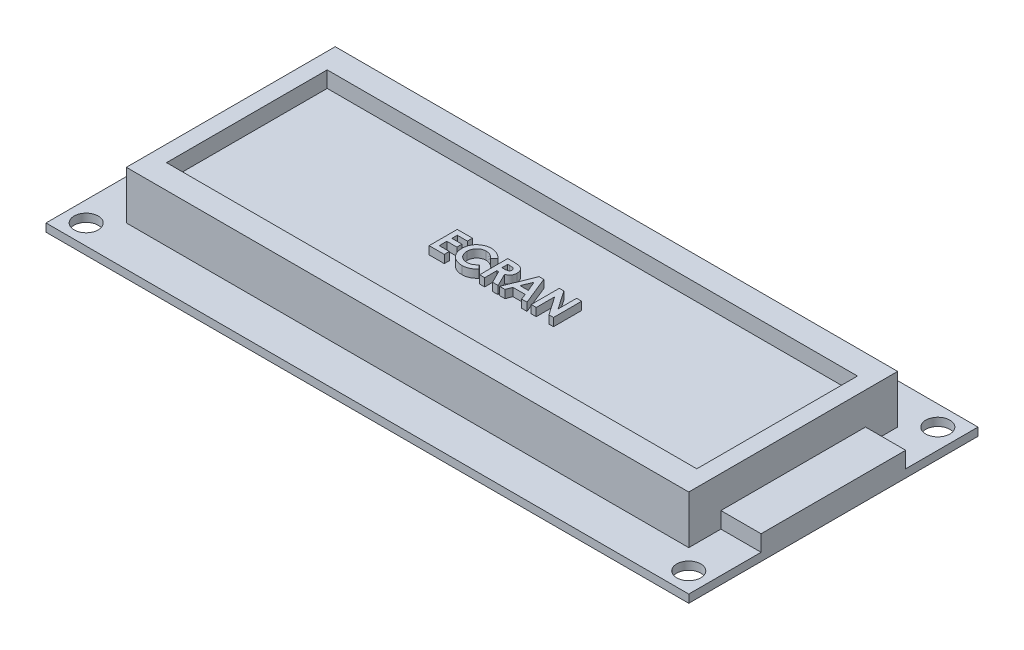
from build123d import *

# Parameters (mm, degrees)
ESQUISSE1_W                = 80
ESQUISSE1_H                = 36
ESQUISSE1_R                = 1.5
PLAQUE_PCB_DEPTH           = 1
ESQUISSE2_W                = 70
ESQUISSE2_H                = 26
CADRE_ECRAN_DEPTH          = 6
ESQUISSE5_W                = 66
ESQUISSE5_H                = 20
VITRE_ECRAN_DEPTH          = 2
TEXTE_ECRAN_DEPTH          = 1
BLOC_RETROECLAIREAGE_DEPTH = 2


with BuildPart() as part:
    # Esquisse1 → Plaque PCB (new body)
    with BuildSketch(Plane(origin=(0, 0, 0), x_dir=(1, 0, 0), z_dir=(0, 1, 0))):
        with Locations((40, 18)):
            Rectangle(ESQUISSE1_W, ESQUISSE1_H)
        with Locations(Location((2.5, 33.5, 0), (0, 0, 270))):
            Circle(ESQUISSE1_R, mode=Mode.SUBTRACT)
        with Locations(Location((77.5, 33.5, 0), (0, 0, 270))):
            Circle(ESQUISSE1_R, mode=Mode.SUBTRACT)
        with Locations(Location((2.5, 2.5, 0), (0, 0, 270))):
            Circle(ESQUISSE1_R, mode=Mode.SUBTRACT)
        with Locations(Location((77.5, 2.5, 0), (0, 0, 270))):
            Circle(ESQUISSE1_R, mode=Mode.SUBTRACT)
    extrude(amount=PLAQUE_PCB_DEPTH)

    # Esquisse2 → Cadre ecran (add)
    with BuildSketch(Plane(origin=(0, 1, 0), x_dir=(1, 0, 0), z_dir=(0, 1, 0))):
        with Locations((40, 18)):
            Rectangle(ESQUISSE2_W, ESQUISSE2_H)
    extrude(amount=CADRE_ECRAN_DEPTH)

    # Esquisse5 → Vitre ecran (cut)
    with BuildSketch(Plane(origin=(0, 7, 0), x_dir=(1, 0, 0), z_dir=(0, 1, 0))):
        with Locations((40, 18)):
            Rectangle(ESQUISSE5_W, ESQUISSE5_H)
    extrude(amount=-VITRE_ECRAN_DEPTH, mode=Mode.SUBTRACT)

    # Esquisse6 → Texte ECRAN (add)
    # profile 1 of 5: a face of its own
    with BuildSketch(Plane(origin=(0, 5, 0), x_dir=(1, 0, 0), z_dir=(0, 1, 0))):
        Polygon((31.289059195, 19.898736743), (33.173674579, 19.898736743), (33.173674579, 19.270531615), (31.917264323, 19.270531615), (31.917264323, 18.597454692), (33.173674579, 18.597454692), (33.173674579, 17.969249564), (31.917264323, 17.969249564), (31.917264323, 17.026941871), (33.173674579, 17.026941871), (33.173674579, 16.398736743), (31.289059195, 16.398736743), align=None)
    # profile 2 of 5: a face of its own
    with BuildSketch(Plane(origin=(0, 5, 0), x_dir=(1, 0, 0), z_dir=(0, 1, 0))):
        with BuildLine():
            Line((36.942905348, 19.291565269), (36.482268329, 18.851260782))
            add(Edge.make_bspline(
                [(36.482268329, 18.851260782), (36.443193344, 18.891664381), (36.366867658, 18.97058527), (36.243878253, 19.07506957), (36.11597375, 19.162143098), (35.985642275, 19.235475868), (35.850539544, 19.290957336), (35.712227712, 19.331387616), (35.569823617, 19.356036429), (35.473450002, 19.35885669), (35.424976663, 19.360275205)],
                knots=[0, 0, 0, 0, 1.115251505, 2.178435587, 3.19620269, 4.182487026, 5.141301733, 6.088180966, 7.038406374, 8, 8, 8, 8], degree=3))
            add(Edge.make_bspline(
                [(35.424976663, 19.360275205), (35.384495533, 19.359154528), (35.304610485, 19.356942996), (35.1873183, 19.340730286), (35.075122263, 19.313159867), (34.96763831, 19.275162722), (34.865182716, 19.225996434), (34.767540671, 19.165699055), (34.674952908, 19.094815156), (34.588642456, 19.013711495), (34.509688687, 18.925099651), (34.439928006, 18.830551024), (34.381492245, 18.730282221), (34.333534967, 18.62530869), (34.2961781, 18.515144562), (34.269500605, 18.399864003), (34.254071054, 18.279329723), (34.25176809, 18.197391418), (34.250597656, 18.155747961)],
                knots=[0, 0, 0, 0, 1.035432265, 2.043311493, 3.022114605, 3.98653278, 4.95457646, 5.923598177, 6.917315552, 7.932509744, 8.948865224, 9.949768934, 10.933144597, 11.912367597, 12.897413939, 13.903909035, 14.934704909, 16, 16, 16, 16], degree=3))
            add(Edge.make_bspline(
                [(34.250597656, 18.155747961), (34.250934962, 18.126519669), (34.251599798, 18.068910106), (34.25887761, 17.983689572), (34.270596602, 17.901005507), (34.287556887, 17.820983155), (34.308765891, 17.743553169), (34.333648881, 17.668047563), (34.364864227, 17.595509655), (34.399513731, 17.525096965), (34.439810706, 17.45873079), (34.483258278, 17.395445135), (34.530370076, 17.335550218), (34.581451247, 17.279290894), (34.637220694, 17.227546367), (34.696236983, 17.178760621), (34.759495637, 17.134154925), (34.825682615, 17.092609853), (34.895369687, 17.056519295), (34.966666081, 17.023828222), (35.040652796, 16.99727821), (35.116428998, 16.975876479), (35.19372389, 16.957677502), (35.273293487, 16.946471833), (35.354448021, 16.937985911), (35.409294864, 16.937461955), (35.436895733, 16.937198282)],
                knots=[0, 0, 0, 0, 1.103660481, 2.175337485, 3.227646561, 4.255952547, 5.262355991, 6.258840057, 7.255597736, 8.242457506, 9.22035537, 10.185017736, 11.140346927, 12.096287581, 13.051739095, 14.01125915, 14.986044842, 15.97314143, 16.960198552, 17.947847494, 18.933482797, 19.925264591, 20.920966487, 21.929612487, 22.958107872, 24, 24, 24, 24], degree=3))
            add(Edge.make_bspline(
                [(35.436895733, 16.937198282), (35.48371155, 16.938552444), (35.575692456, 16.941213019), (35.710687662, 16.962018347), (35.839324644, 16.996241932), (35.942104977, 17.036657998), (36.022630654, 17.076569388), (36.083933661, 17.113485458), (36.147325748, 17.154780136), (36.211754027, 17.202011927), (36.277943188, 17.254614031), (36.34472484, 17.313738532), (36.413808605, 17.377438545), (36.459064694, 17.422902495), (36.482268329, 17.446212705)],
                knots=[0, 0, 0, 0, 1.404581149, 2.759636711, 4.088442092, 5.392261763, 6.066678138, 6.783632037, 7.538459478, 8.336747902, 9.180226004, 10.074962426, 11.012997595, 12, 12, 12, 12], degree=3))
            Line((36.482268329, 17.446212705), (36.928882913, 16.977162224))
            add(Edge.make_bspline(
                [(36.928882913, 16.977162224), (36.897488311, 16.946851722), (36.836212763, 16.887692104), (36.743780301, 16.803690968), (36.651464168, 16.728206609), (36.561494531, 16.658499275), (36.472397592, 16.596599712), (36.384182801, 16.542446098), (36.297848787, 16.494668811), (36.211602798, 16.454073592), (36.124908165, 16.419604035), (36.035709576, 16.389928008), (35.943734342, 16.364823157), (35.84842072, 16.34456684), (35.750657739, 16.328324007), (35.649530465, 16.31736019), (35.545680097, 16.30998958), (35.475236783, 16.309327269), (35.43970022, 16.308993153)],
                knots=[0, 0, 0, 0, 1.244526981, 2.429050516, 3.560637417, 4.644440555, 5.67424972, 6.652764056, 7.595344123, 8.486817594, 9.369275933, 10.254498637, 11.166417451, 12.086725134, 13.032340136, 13.991389299, 14.986715468, 16, 16, 16, 16], degree=3))
            add(Edge.make_bspline(
                [(35.43970022, 16.308993153), (35.374423956, 16.310657176), (35.246696452, 16.313913204), (35.059515126, 16.338038173), (34.88169789, 16.378483259), (34.712812149, 16.435683765), (34.552911605, 16.508754731), (34.402037165, 16.598336304), (34.260432004, 16.70419048), (34.129240015, 16.825076546), (34.010570618, 16.958585057), (33.905680612, 17.101936572), (33.818915596, 17.255835609), (33.746872734, 17.418008589), (33.690536163, 17.589195571), (33.650884767, 17.769581726), (33.626432041, 17.95899288), (33.623756878, 18.088365064), (33.622392528, 18.154345718)],
                knots=[0, 0, 0, 0, 1.078019885, 2.10938526, 3.111377082, 4.085535484, 5.04941344, 6.010039228, 6.978205633, 7.964457913, 8.951525778, 9.924444315, 10.892603023, 11.863865945, 12.85144698, 13.863884204, 14.910567087, 16, 16, 16, 16], degree=3))
            add(Edge.make_bspline(
                [(33.622392528, 18.154345718), (33.622969036, 18.197377737), (33.624111535, 18.282656681), (33.636119302, 18.408279476), (33.652858828, 18.53073923), (33.679414564, 18.648764406), (33.711424884, 18.76394502), (33.751233923, 18.875029194), (33.7987781, 18.982336195), (33.852524955, 19.08604566), (33.913328234, 19.185478183), (33.981252171, 19.279779481), (34.05454814, 19.369677542), (34.134977323, 19.453979702), (34.221370979, 19.53342615), (34.314119165, 19.607586351), (34.412664048, 19.677523846), (34.517272351, 19.741435116), (34.625911814, 19.799246257), (34.737212208, 19.850238153), (34.85090008, 19.892855635), (34.966494748, 19.928205264), (35.084484598, 19.954591263), (35.204027448, 19.974564612), (35.326140464, 19.985729843), (35.408128776, 19.987557662), (35.449515925, 19.988480333)],
                knots=[0, 0, 0, 0, 1.071919942, 2.124283339, 3.142214191, 4.149696895, 5.136002878, 6.119640489, 7.086990633, 8.058538607, 9.028339693, 9.988281803, 10.952401235, 11.916291999, 12.888973767, 13.874849856, 14.873389453, 15.898127285, 16.927174885, 17.938320013, 18.946391617, 19.950418109, 20.947802303, 21.956882652, 22.968648068, 24, 24, 24, 24], degree=3))
            add(Edge.make_bspline(
                [(35.449515925, 19.988480333), (35.484823408, 19.987951435), (35.555071272, 19.986899138), (35.659682131, 19.978127097), (35.763456362, 19.964350697), (35.86602242, 19.943565042), (35.968113963, 19.918889842), (36.068389394, 19.886581073), (36.168430611, 19.85056686), (36.266668618, 19.807519223), (36.36324054, 19.760528838), (36.455884027, 19.70721654), (36.546154555, 19.650863108), (36.632051783, 19.588133299), (36.715184752, 19.52130244), (36.795118751, 19.450058728), (36.871152314, 19.37321432), (36.918866757, 19.318919209), (36.942905348, 19.291565269)],
                knots=[0, 0, 0, 0, 0.996412454, 1.982464992, 2.961075852, 3.949442424, 4.934965278, 5.923860011, 6.921385422, 7.934793307, 8.949617135, 9.951082467, 10.950285876, 11.951772932, 12.951063433, 13.960125323, 14.972308753, 16, 16, 16, 16], degree=3))
        make_face()
    # profile 3 of 5: a face of its own
    with BuildSketch(Plane(origin=(0, 5, 0), x_dir=(1, 0, 0), z_dir=(0, 1, 0))):
        with BuildLine():
            Line((37.571110477, 19.898736743), (38.30308163, 19.898736743))
            add(Edge.make_bspline(
                [(38.30308163, 19.898736743), (38.351464701, 19.898565011), (38.444518974, 19.898234722), (38.578698154, 19.893023632), (38.701960183, 19.885771973), (38.814487562, 19.874705749), (38.91623215, 19.860033273), (39.007295919, 19.842736853), (39.087676207, 19.823023873), (39.158050912, 19.798459945), (39.221560602, 19.770752206), (39.280760463, 19.738915507), (39.336956532, 19.703304358), (39.389773198, 19.662981734), (39.439669451, 19.618673029), (39.486739423, 19.570333642), (39.530317972, 19.517553675), (39.570135257, 19.46066663), (39.606425508, 19.400822763), (39.638498478, 19.337939909), (39.66458027, 19.271974335), (39.68762633, 19.203879389), (39.70422566, 19.132681637), (39.715770251, 19.059074204), (39.724222749, 18.982797983), (39.724708728, 18.930979305), (39.72495663, 18.904546038)],
                knots=[0, 0, 0, 0, 1.749336639, 3.364467119, 4.854658419, 6.213483162, 7.451590619, 8.570285859, 9.5643256, 10.440900261, 11.26203566, 12.067320669, 12.869050712, 13.665104639, 14.467235401, 15.27997916, 16.102287765, 16.939272006, 17.78853747, 18.631303466, 19.488103222, 20.351255419, 21.228522269, 22.127379805, 23.044756219, 24, 24, 24, 24], degree=3))
            add(Edge.make_bspline(
                [(39.72495663, 18.904546038), (39.724312668, 18.87695578), (39.723049976, 18.822856311), (39.716248427, 18.743388604), (39.703817333, 18.667359461), (39.684988633, 18.594991485), (39.663347487, 18.525383972), (39.634570314, 18.459821226), (39.602092431, 18.397349729), (39.563519398, 18.338853167), (39.521187378, 18.283032212), (39.47195613, 18.232025574), (39.419015082, 18.183091837), (39.359388224, 18.139296047), (39.295703965, 18.097676888), (39.226696965, 18.059958847), (39.152817587, 18.025193778), (39.100876725, 18.005806374), (39.074315605, 17.995892192)],
                knots=[0, 0, 0, 0, 1.099860209, 2.156625411, 3.176576793, 4.16617041, 5.135385252, 6.078461593, 7.016046972, 7.938469504, 8.868247731, 9.803980173, 10.76021508, 11.73834243, 12.748633912, 13.790971185, 14.870363756, 16, 16, 16, 16], degree=3))
            Line((39.074315605, 17.995892192), (39.882007913, 16.398736743))
            Line((39.882007913, 16.398736743), (39.183690605, 16.398736743))
            Line((39.183690605, 16.398736743), (38.41245663, 17.924377769))
            Line((38.41245663, 17.924377769), (38.199315605, 17.924377769))
            Line((38.199315605, 17.924377769), (38.199315605, 16.398736743))
            Line((38.199315605, 16.398736743), (37.571110477, 16.398736743))
            Line((37.571110477, 16.398736743), (37.571110477, 19.898736743))
        make_face()
        with BuildLine():
            Line((38.199315605, 18.552582897), (38.444007111, 18.552582897))
            add(Edge.make_bspline(
                [(38.444007111, 18.552582897), (38.473922682, 18.552919826), (38.531204572, 18.553564973), (38.613583453, 18.556557433), (38.688403123, 18.563767783), (38.755984883, 18.57287779), (38.816668799, 18.583396609), (38.869913591, 18.598470715), (38.916539681, 18.614623002), (38.955994547, 18.634696104), (38.989703878, 18.657523574), (39.018809727, 18.683456149), (39.042884438, 18.713469801), (39.062699153, 18.74674889), (39.078112847, 18.783587762), (39.089363663, 18.823582008), (39.095651205, 18.867187215), (39.096374609, 18.897280745), (39.096751502, 18.9129595)],
                knots=[0, 0, 0, 0, 1.688639943, 3.233382647, 4.650958383, 5.928841754, 7.082724185, 8.122798841, 9.049171256, 9.863274652, 10.613301712, 11.341792392, 12.054588806, 12.776240173, 13.521029143, 14.301969904, 15.115324896, 16, 16, 16, 16], degree=3))
            add(Edge.make_bspline(
                [(39.096751502, 18.9129595), (39.09603895, 18.931508611), (39.094639274, 18.967944902), (39.080750136, 19.020400386), (39.05864163, 19.068951525), (39.028336923, 19.113378953), (38.990172084, 19.152327104), (38.94637492, 19.186660209), (38.896000183, 19.213808259), (38.849356967, 19.231714824), (38.806922543, 19.242428507), (38.768626814, 19.250412248), (38.724280129, 19.256070555), (38.67384901, 19.262072196), (38.617462006, 19.265963957), (38.554811774, 19.268804167), (38.486078247, 19.269966236), (38.43816445, 19.270337729), (38.413157752, 19.270531615)],
                knots=[0, 0, 0, 0, 1.020303359, 2.004196876, 2.966617323, 3.9489082, 4.950758222, 5.960522915, 7.003732012, 8.091992268, 8.70421221, 9.413913587, 10.24622431, 11.166358409, 12.212345909, 13.359657661, 14.621978493, 16, 16, 16, 16], degree=3))
            Line((38.413157752, 19.270531615), (38.199315605, 19.270531615))
            Line((38.199315605, 19.270531615), (38.199315605, 18.552582897))
        make_face(mode=Mode.SUBTRACT)
    # profile 4 of 5: a face of its own
    with BuildSketch(Plane(origin=(0, 5, 0), x_dir=(1, 0, 0), z_dir=(0, 1, 0))):
        Polygon((41.475657752, 19.898736743), (42.058289964, 19.898736743), (43.471751502, 16.398736743), (42.800777945, 16.398736743), (42.528742688, 17.116685461), (41.003802784, 17.116685461), (40.731767528, 16.398736743), (40.061495092, 16.398736743), align=None)
        Polygon((41.766623297, 18.95993466), (41.242184195, 17.744890589), (42.2910624, 17.744890589), align=None, mode=Mode.SUBTRACT)
    # profile 5 of 5: a face of its own
    with BuildSketch(Plane(origin=(0, 5, 0), x_dir=(1, 0, 0), z_dir=(0, 1, 0))):
        Polygon((43.987777143, 19.898736743), (44.553582432, 19.898736743), (46.141623297, 17.595551647), (46.141623297, 19.898736743), (46.769828425, 19.898736743), (46.769828425, 16.398736743), (46.199816406, 16.398736743), (44.615982271, 18.694910621), (44.615982271, 16.398736743), (43.987777143, 16.398736743), align=None)
    extrude(amount=TEXTE_ECRAN_DEPTH)

    # Esquisse9 → Bloc Retroeclaireage (add)
    with BuildSketch(Plane(origin=(0, 1, 0), x_dir=(1, 0, 0), z_dir=(0, 1, 0))):
        Polygon((80, 18), (80, 9), (75, 9), (75, 27), (80, 27), align=None)
    extrude(amount=BLOC_RETROECLAIREAGE_DEPTH)


solid = part.part
